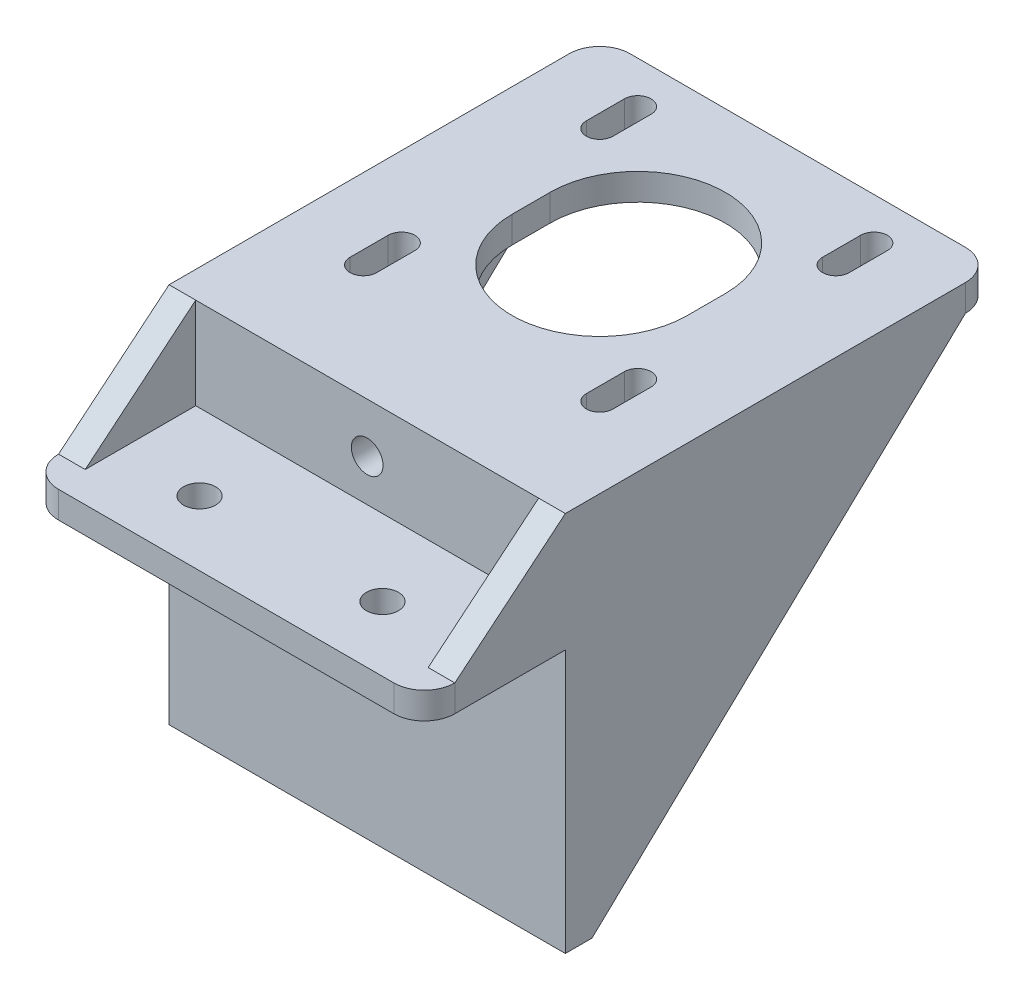
from build123d import *

# Parameters (mm, degrees)
SKETCH1_R               = 2.1
BOSS_EXTRUDE1_DEPTH     = 50
CUT_EXTRUDE1_DEPTH      = 77.342976101
CUT_EXTRUDE1_DEPTH_BACK = 77.342976101
SKETCH2_W               = 18.5
SKETCH2_H               = 12
SKETCH2_W_2             = 53
SKETCH2_H_2             = 46.5
SKETCH2_H_3             = 34.5
BOSS_EXTRUDE2_DEPTH     = 3.5
SKETCH4_R               = 2.08
CUT_EXTRUDE2_DEPTH      = 78.362781749


with BuildPart() as part:
    # Sketch1 → Boss-Extrude1 (new body)
    with BuildSketch(Plane(origin=(0, 0, 0), x_dir=(1, 0, 0), z_dir=(0, 1, 0))):
        with BuildLine():
            Line((22, 23.5), (-22, 23.5))
            ThreePointArc((-22, 23.5), (-24.828427125, 22.328427125), (-26, 19.5))
            Line((-26, 19.5), (-26, -47.5))
            ThreePointArc((-26, -47.5), (-24.828427125, -50.328427125), (-22, -51.5))
            Line((-22, -51.5), (22, -51.5))
            ThreePointArc((22, -51.5), (24.828427125, -50.328427125), (26, -47.5))
            Line((26, -47.5), (26, 19.5))
            ThreePointArc((26, 19.5), (24.828427125, 22.328427125), (22, 23.5))
        make_face()
        with Locations((-12, -43)):
            Circle(SKETCH1_R, mode=Mode.SUBTRACT)
        with Locations((12, -43)):
            Circle(SKETCH1_R, mode=Mode.SUBTRACT)
        with BuildLine():
            Line((11.5, 2.5), (11.5, -2.5))
            ThreePointArc((11.5, -2.5), (0, -14), (-11.5, -2.5))
            Line((-11.5, -2.5), (-11.5, 2.5))
            ThreePointArc((-11.5, 2.5), (0, 14), (11.5, 2.5))
        make_face(mode=Mode.SUBTRACT)
        with BuildLine():
            Line((-13.75, 18), (-13.75, 13))
            ThreePointArc((-13.75, 13), (-15.5, 11.25), (-17.25, 13))
            Line((-17.25, 13), (-17.25, 18))
            ThreePointArc((-17.25, 18), (-15.5, 19.75), (-13.75, 18))
        make_face(mode=Mode.SUBTRACT)
        with BuildLine():
            Line((17.25, 18), (17.25, 13))
            ThreePointArc((17.25, 13), (15.5, 11.25), (13.75, 13))
            Line((13.75, 13), (13.75, 18))
            ThreePointArc((13.75, 18), (15.5, 19.75), (17.25, 18))
        make_face(mode=Mode.SUBTRACT)
        with BuildLine():
            Line((17.25, -13), (17.25, -18))
            ThreePointArc((17.25, -18), (15.5, -19.75), (13.75, -18))
            Line((13.75, -18), (13.75, -13))
            ThreePointArc((13.75, -13), (15.5, -11.25), (17.25, -13))
        make_face(mode=Mode.SUBTRACT)
        with BuildLine():
            Line((-13.75, -13), (-13.75, -18))
            ThreePointArc((-13.75, -18), (-15.5, -19.75), (-17.25, -18))
            Line((-17.25, -18), (-17.25, -13))
            ThreePointArc((-17.25, -13), (-15.5, -11.25), (-13.75, -13))
        make_face(mode=Mode.SUBTRACT)
    extrude(amount=BOSS_EXTRUDE1_DEPTH)

    # Sketch2 → Cut-Extrude1 (cut, two sides: drawn at the far end of the back side and taken through both)
    with BuildSketch(Plane(origin=(0, 0, 0), x_dir=(0, 0, -1), z_dir=(1, 0, 0)).offset(-CUT_EXTRUDE1_DEPTH_BACK)):
        with Locations((-42.25, 44)):
            Rectangle(SKETCH2_W, SKETCH2_H)
        with Locations((-3, 23.25)):
            Rectangle(SKETCH2_W_2, SKETCH2_H_2)
        with Locations((-42.25, 17.25)):
            Rectangle(SKETCH2_W, SKETCH2_H_3)
    extrude(amount=CUT_EXTRUDE1_DEPTH + CUT_EXTRUDE1_DEPTH_BACK, mode=Mode.SUBTRACT)

    # Sketch3 → Boss-Extrude2 (add)
    with BuildSketch(Plane(origin=(26, 0, 0), x_dir=(0, 0, -1), z_dir=(1, 0, 0))):
        Polygon((19.5, 46.5), (-29.5, 0), (-29.5, 46.5), align=None)
        Polygon((-33, 50), (-47.5, 38), (-33, 38), align=None)
    boss_extrude2 = extrude(amount=-BOSS_EXTRUDE2_DEPTH)

    # Mirror1: Boss-Extrude2 across plane
    add(boss_extrude2.mirror(Plane(origin=(0, 0, 0), x_dir=(0, 0, 1), z_dir=(1, 0, 0))))

    # Sketch4 → Cut-Extrude2 (cut, through all)
    with BuildSketch(Plane(origin=(0, 0, 29.5), x_dir=(-1, 0, 0), z_dir=(0, 0, -1))):
        with Locations((-12, 24.5)):
            Circle(SKETCH4_R)
        with Locations((12, 24.5)):
            Circle(SKETCH4_R)
        with Locations((0, 43.5)):
            Circle(SKETCH4_R)
    extrude(amount=-CUT_EXTRUDE2_DEPTH, mode=Mode.SUBTRACT)


solid = part.part
